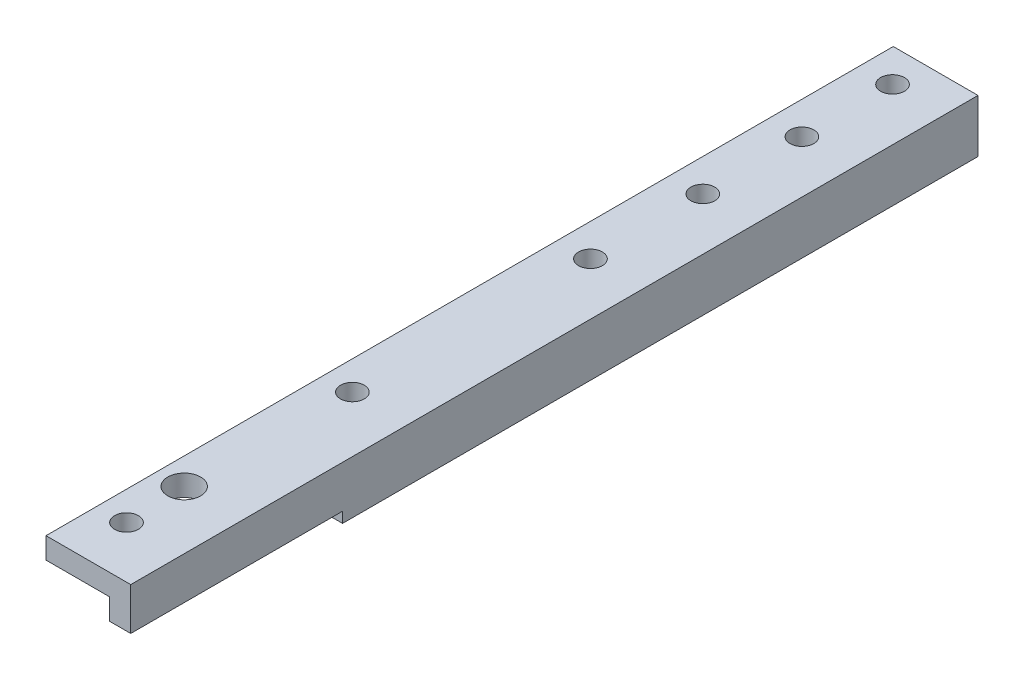
from build123d import *

# Parameters (mm, degrees)
BOSS_EXTRUDE1_DEPTH  = 160
SKETCH2_W            = 40
SKETCH2_H            = 2
CUT_EXTRUDE1_DEPTH   = 4
M4_CLEARANCE_HOLE1_D = 4.5
CUT_EXTRUDE2_REACH   = 163.357
SKETCH5_R            = 3.1


with BuildPart() as part:
    # Sketch1 → Boss-Extrude1 (new body)
    with BuildSketch(Plane.XY):
        Polygon((4, -4), (16, -4), (16, -10), (20, -10), (20, 0), (16, 0), (4, 0), align=None)
    extrude(amount=BOSS_EXTRUDE1_DEPTH)

    # Sketch2 → Cut-Extrude1 (cut)
    with BuildSketch(Plane(origin=(20, 0, 0), x_dir=(0, 0, -1), z_dir=(1, 0, 0))):
        with Locations((-140, -9)):
            Rectangle(SKETCH2_W, SKETCH2_H)
    extrude(amount=-CUT_EXTRUDE1_DEPTH, mode=Mode.SUBTRACT)

    # M4 Clearance Hole1 (through all)
    with Locations(Plane(origin=(0, -4, 0), x_dir=(-1, 0, 0), z_dir=(0, -1, 0))):
        with Locations((-10.128911503, -6.267286375), (-10.128911503, -23.38156703), (-10.128911503, -42.093180546), (-10.128911503, -63.314888558), (-9.444340277, -107.583827852), (-9.444340277, -150.244789298)):
            Hole(M4_CLEARANCE_HOLE1_D / 2)

    # Sketch5 → Cut-Extrude2 (cut, up to next)
    with BuildSketch(Plane.XZ.offset(4), mode=Mode.PRIVATE) as cut_extrude2_sk1:
        with Locations(Location((9, 138.897931951, 0), (0, 0, 270))):
            Circle(SKETCH5_R)
    cut_extrude2_tool1 = extrude(cut_extrude2_sk1.sketch, amount=-CUT_EXTRUDE2_REACH, mode=Mode.PRIVATE) & part.part
    add(cut_extrude2_tool1.solids().sort_by_distance((9, -4, 138.897932))[0], mode=Mode.SUBTRACT)


solid = part.part
